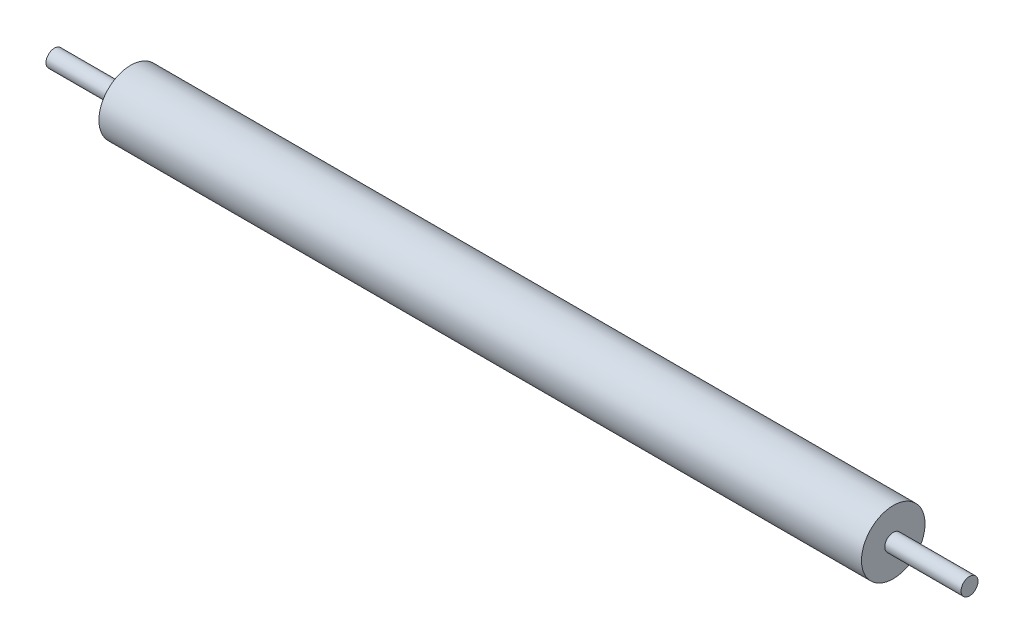
from build123d import *

# Parameters (mm, degrees)
SKETCH2_R           = 15
BOSS_EXTRUDE1_DEPTH = 180
SKETCH3_R           = 4
BOSS_EXTRUDE2_DEPTH = 36


with BuildPart() as part:
    # Sketch2 → Boss-Extrude1 (new body)
    with BuildSketch(Plane(origin=(0, 0, 0), x_dir=(0, 0, -1), z_dir=(1, 0, 0))):
        with Locations(Location((0, 0, 0), (0, 0, 180))):
            Circle(SKETCH2_R)
    boss_extrude1 = extrude(amount=BOSS_EXTRUDE1_DEPTH)

    # Sketch3 → Boss-Extrude2 (add)
    with BuildSketch(Plane(origin=(180, 0, 0), x_dir=(0, 0, -1), z_dir=(1, 0, 0))):
        Circle(SKETCH3_R)
    boss_extrude2 = extrude(amount=BOSS_EXTRUDE2_DEPTH)

    # Mirror1: Boss-Extrude1, Boss-Extrude2 across plane
    add(boss_extrude1.mirror(Plane(origin=(0, 0, 0), x_dir=(0, 0, 1), z_dir=(1, 0, 0))))
    add(boss_extrude2.mirror(Plane(origin=(0, 0, 0), x_dir=(0, 0, 1), z_dir=(1, 0, 0))))


solid = part.part
